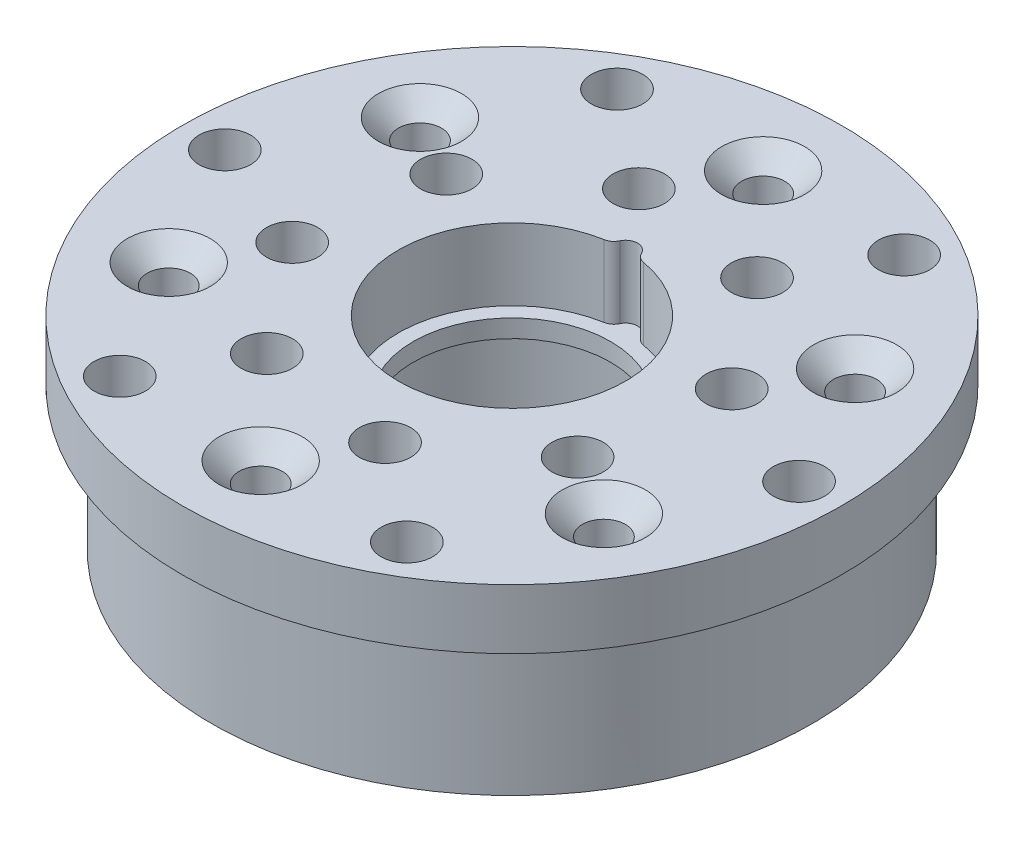
from build123d import *

# Parameters (mm, degrees)
SKETCH1_R                                            = 25.1
SKETCH1_R_2                                          = 2.5
SKETCH1_R_3                                          = 8.25
BOSS_EXTRUDE1_DEPTH                                  = 10
SKETCH2_R                                            = 15.5
SKETCH2_R_2                                          = 9.5
BOSS_EXTRUDE2_DEPTH                                  = 8.5
SKETCH4_R                                            = 9.5
SKETCH4_R_2                                          = 8.25
BOSS_EXTRUDE3_DEPTH                                  = 2.5
SKETCH3_R                                            = 12.5
CUT_EXTRUDE1_DEPTH                                   = 11
CHAMFER1_SIZE                                        = 3
SKETCH5_R                                            = 25.1
SKETCH5_R_2                                          = 2.5
SKETCH5_R_3                                          = 15.5
BOSS_EXTRUDE4_DEPTH                                  = 8.5
BOSS_EXTRUDE5_START                                  = -5
SKETCH6_R                                            = 27.55
SKETCH6_R_2                                          = 25.1
BOSS_EXTRUDE5_DEPTH                                  = 5
SKETCH8_R                                            = 1
CUT_EXTRUDE2_DEPTH                                   = 6
FILLET1_R                                            = 1
SKETCH11_R                                           = 2.15
CUT_EXTRUDE3_DEPTH                                   = 4.8
SKETCH12_R                                           = 25.1
SKETCH12_R_2                                         = 2.5
SKETCH12_R_3                                         = 12.5
CUT_EXTRUDE4_DEPTH                                   = 1.5
BOSS_EXTRUDE8_START                                  = -4.5
SKETCH14_R                                           = 2.5
SKETCH14_R_2                                         = 1.5
BOSS_EXTRUDE8_DEPTH                                  = 4.5
CSK_FOR_M3_SOCKET_COUNTERSUNK_HEAD_SCREW_D           = 3.6
CSK_FOR_M3_SOCKET_COUNTERSUNK_HEAD_SCREW_CSINK_D     = 6.94
CSK_FOR_M3_SOCKET_COUNTERSUNK_HEAD_SCREW_CSINK_ANGLE = 90


with BuildPart() as part:
    # Sketch1 → Boss-Extrude1 (new body)
    with BuildSketch(Plane(origin=(0, 0, 0), x_dir=(1, 0, 0), z_dir=(0, 1, 0))):
        with Locations(Location((0, 0, 0), (0, 0, 270))):
            Circle(SKETCH1_R)
        with Locations(Location((0, 21, 0), (0, 0, 270))):
            Circle(SKETCH1_R_2, mode=Mode.SUBTRACT)
        with Locations(Location((18.186533479, 10.5, 0), (0, 0, 270))):
            Circle(SKETCH1_R_2, mode=Mode.SUBTRACT)
        with Locations(Location((18.186533479, -10.5, 0), (0, 0, 270))):
            Circle(SKETCH1_R_2, mode=Mode.SUBTRACT)
        with Locations(Location((0, -21, 0), (0, 0, 270))):
            Circle(SKETCH1_R_2, mode=Mode.SUBTRACT)
        with Locations(Location((-18.186533479, -10.5, 0), (0, 0, 270))):
            Circle(SKETCH1_R_2, mode=Mode.SUBTRACT)
        with Locations(Location((-18.186533479, 10.5, 0), (0, 0, 270))):
            Circle(SKETCH1_R_2, mode=Mode.SUBTRACT)
        with Locations(Location((0, 0, 0), (0, 0, 270))):
            Circle(SKETCH1_R_3, mode=Mode.SUBTRACT)
    extrude(amount=BOSS_EXTRUDE1_DEPTH)

    # Sketch2 → Boss-Extrude2 (add)
    with BuildSketch(Plane(origin=(0, 10, 0), x_dir=(1, 0, 0), z_dir=(0, 1, 0))):
        with Locations(Location((0, 0, 0), (0, 0, 270))):
            Circle(SKETCH2_R)
        with Locations(Location((0, 0, 0), (0, 0, 270))):
            Circle(SKETCH2_R_2, mode=Mode.SUBTRACT)
    extrude(amount=BOSS_EXTRUDE2_DEPTH)

    # Sketch4 → Boss-Extrude3 (add)
    with BuildSketch(Plane(origin=(0, 10, 0), x_dir=(1, 0, 0), z_dir=(0, 1, 0))):
        with Locations(Location((0, 0, 0), (0, 0, 270))):
            Circle(SKETCH4_R)
        with Locations(Location((0, 0, 0), (0, 0, 270))):
            Circle(SKETCH4_R_2, mode=Mode.SUBTRACT)
    extrude(amount=BOSS_EXTRUDE3_DEPTH)

    # Sketch3 → Cut-Extrude1 (cut)
    with BuildSketch(Plane.XZ):
        with Locations(Location((0, 0, 0), (0, 0, 270))):
            Circle(SKETCH3_R)
    extrude(amount=-CUT_EXTRUDE1_DEPTH, mode=Mode.SUBTRACT)

    # Chamfer1
    chamfer1_edges = [part.edges().sort_by_distance(p)[0] for p in [
        (0, 11, 12.5),
    ]]
    chamfer(chamfer1_edges, length=CHAMFER1_SIZE)

    # Sketch5 → Boss-Extrude4 (add)
    with BuildSketch(Plane(origin=(0, 10, 0), x_dir=(1, 0, 0), z_dir=(0, 1, 0))):
        with Locations(Location((0, 0, 0), (0, 0, 270))):
            Circle(SKETCH5_R)
        with Locations(Location((0, 21, 0), (0, 0, 270))):
            Circle(SKETCH5_R_2, mode=Mode.SUBTRACT)
        with Locations(Location((18.187152059, 10.499642863, 0), (0, 0, 60.008184899))):
            Circle(SKETCH5_R_2, mode=Mode.SUBTRACT)
        with Locations(Location((18.187152059, -10.50107141, 0), (0, 0, 30.014176717))):
            Circle(SKETCH5_R_2, mode=Mode.SUBTRACT)
        with Locations(Location((0, -21.001428547, 0), (0, 0, 179.983629985))):
            Circle(SKETCH5_R_2, mode=Mode.SUBTRACT)
        with Locations(Location((-18.187152059, -10.50107141, 0), (0, 0, 149.985823141))):
            Circle(SKETCH5_R_2, mode=Mode.SUBTRACT)
        with Locations(Location((-18.187152059, 10.499642863, 0), (0, 0, 119.991814957))):
            Circle(SKETCH5_R_2, mode=Mode.SUBTRACT)
        Circle(SKETCH5_R_3, mode=Mode.SUBTRACT)
    extrude(amount=BOSS_EXTRUDE4_DEPTH)

    # Sketch6 → Boss-Extrude5 (add)
    with BuildSketch(Plane(origin=(0, 18.5, 0), x_dir=(1, 0, 0), z_dir=(0, 1, 0)).offset(BOSS_EXTRUDE5_START)):
        with Locations(Location((0, 0, 0), (0, 0, 270))):
            Circle(SKETCH6_R)
        with Locations(Location((0, 0, 0), (0, 0, 270))):
            Circle(SKETCH6_R_2, mode=Mode.SUBTRACT)
    extrude(amount=BOSS_EXTRUDE5_DEPTH)

    # Sketch8 → Cut-Extrude2 (cut)
    with BuildSketch(Plane(origin=(0, 18.5, 0), x_dir=(1, 0, 0), z_dir=(0, 1, 0))):
        with Locations((0, 9.5)):
            Circle(SKETCH8_R)
    extrude(amount=-CUT_EXTRUDE2_DEPTH, mode=Mode.SUBTRACT)

    # Fillet1
    fillet1_edges = [part.edges().sort_by_distance(p)[0] for p in [
        (0.998613998, 15.5, -9.447368421),
        (-0.998613998, 15.5, -9.447368421),
    ]]
    fillet(fillet1_edges, radius=FILLET1_R)

    # Sketch11 → Cut-Extrude3 (cut)
    with BuildSketch(Plane(origin=(0, 18.5, 0), x_dir=(1, 0, 0), z_dir=(0, 1, 0))):
        with Locations(Location((7.5, 12.990381057, 0), (0, 0, 270))):
            Circle(SKETCH11_R)
        with Locations(Location((14.488887394, 3.882285677, 0), (0, 0, 270))):
            Circle(SKETCH11_R)
        with Locations(Location((12.990381057, -7.5, 0), (0, 0, 270))):
            Circle(SKETCH11_R)
        with Locations(Location((3.882285677, -14.488887394, 0), (0, 0, 270))):
            Circle(SKETCH11_R)
        with Locations(Location((-7.5, -12.990381057, 0), (0, 0, 270))):
            Circle(SKETCH11_R)
        with Locations(Location((-14.488887394, -3.882285677, 0), (0, 0, 270))):
            Circle(SKETCH11_R)
        with Locations(Location((-24, 0, 0), (0, 0, 270))):
            Circle(SKETCH11_R)
        with Locations(Location((-12, 20.784609691, 0), (0, 0, 270))):
            Circle(SKETCH11_R)
        with Locations(Location((12, 20.784609691, 0), (0, 0, 270))):
            Circle(SKETCH11_R)
        with Locations(Location((24, 0, 0), (0, 0, 270))):
            Circle(SKETCH11_R)
        with Locations(Location((12, -20.784609691, 0), (0, 0, 270))):
            Circle(SKETCH11_R)
        with Locations(Location((-12, -20.784609691, 0), (0, 0, 270))):
            Circle(SKETCH11_R)
        with Locations(Location((-12.990381057, 7.5, 0), (0, 0, 270))):
            Circle(SKETCH11_R)
        with Locations(Location((-3.882285677, 14.488887394, 0), (0, 0, 270))):
            Circle(SKETCH11_R)
    extrude(amount=-CUT_EXTRUDE3_DEPTH, mode=Mode.SUBTRACT)

    # Sketch12 → Cut-Extrude4 (cut)
    with BuildSketch(Plane.XZ):
        with Locations(Location((0, 0, 0), (0, 0, 270))):
            Circle(SKETCH12_R)
        with Locations(Location((18.186533479, 10.5, 0), (0, 0, 270))):
            Circle(SKETCH12_R_2, mode=Mode.SUBTRACT)
        with Locations(Location((18.186533479, -10.5, 0), (0, 0, 270))):
            Circle(SKETCH12_R_2, mode=Mode.SUBTRACT)
        with Locations(Location((0, -21, 0), (0, 0, 270))):
            Circle(SKETCH12_R_2, mode=Mode.SUBTRACT)
        with Locations(Location((-18.186533479, -10.5, 0), (0, 0, 270))):
            Circle(SKETCH12_R_2, mode=Mode.SUBTRACT)
        with Locations(Location((-18.186533479, 10.5, 0), (0, 0, 270))):
            Circle(SKETCH12_R_2, mode=Mode.SUBTRACT)
        with Locations(Location((0, 21, 0), (0, 0, 270))):
            Circle(SKETCH12_R_2, mode=Mode.SUBTRACT)
        with Locations(Location((0, 0, 0), (0, 0, 270))):
            Circle(SKETCH12_R_3, mode=Mode.SUBTRACT)
    extrude(amount=-CUT_EXTRUDE4_DEPTH, mode=Mode.SUBTRACT)

    # Sketch14 → Boss-Extrude8 (add)
    # profile 1 of 6: a face of its own
    with BuildSketch(Plane(origin=(0, 18.5, 0), x_dir=(1, 0, 0), z_dir=(0, 1, 0)).offset(BOSS_EXTRUDE8_START)):
        with Locations(Location((0, 21, 0), (0, 0, 90))):
            Circle(SKETCH14_R)
        with Locations(Location((0, 21, 0), (0, 0, 270))):
            Circle(SKETCH14_R_2, mode=Mode.SUBTRACT)
    # profile 2 of 6: a face of its own
    with BuildSketch(Plane(origin=(0, 18.5, 0), x_dir=(1, 0, 0), z_dir=(0, 1, 0)).offset(BOSS_EXTRUDE8_START)):
        with Locations(Location((18.187152059, 10.499642863, 0), (0, 0, 60.008184899))):
            Circle(SKETCH14_R)
        with Locations(Location((18.187152059, 10.499642863, 0), (0, 0, 270))):
            Circle(SKETCH14_R_2, mode=Mode.SUBTRACT)
    # profile 3 of 6: a face of its own
    with BuildSketch(Plane(origin=(0, 18.5, 0), x_dir=(1, 0, 0), z_dir=(0, 1, 0)).offset(BOSS_EXTRUDE8_START)):
        with Locations(Location((18.187152059, -10.50107141, 0), (0, 0, 30.014176717))):
            Circle(SKETCH14_R)
        with Locations(Location((18.187152059, -10.50107141, 0), (0, 0, 270))):
            Circle(SKETCH14_R_2, mode=Mode.SUBTRACT)
    # profile 4 of 6: a face of its own
    with BuildSketch(Plane(origin=(0, 18.5, 0), x_dir=(1, 0, 0), z_dir=(0, 1, 0)).offset(BOSS_EXTRUDE8_START)):
        with Locations(Location((0, -21.001428547, 0), (0, 0, 179.983629985))):
            Circle(SKETCH14_R)
        with Locations(Location((0, -21.001428547, 0), (0, 0, 270))):
            Circle(SKETCH14_R_2, mode=Mode.SUBTRACT)
    # profile 5 of 6: a face of its own
    with BuildSketch(Plane(origin=(0, 18.5, 0), x_dir=(1, 0, 0), z_dir=(0, 1, 0)).offset(BOSS_EXTRUDE8_START)):
        with Locations(Location((-18.187152059, -10.50107141, 0), (0, 0, 149.985823141))):
            Circle(SKETCH14_R)
        with Locations(Location((-18.187152059, -10.50107141, 0), (0, 0, 270))):
            Circle(SKETCH14_R_2, mode=Mode.SUBTRACT)
    # profile 6 of 6: a face of its own
    with BuildSketch(Plane(origin=(0, 18.5, 0), x_dir=(1, 0, 0), z_dir=(0, 1, 0)).offset(BOSS_EXTRUDE8_START)):
        with Locations(Location((-18.187152059, 10.499642863, 0), (0, 0, 119.991814957))):
            Circle(SKETCH14_R)
        with Locations(Location((-18.187152059, 10.499642863, 0), (0, 0, 270))):
            Circle(SKETCH14_R_2, mode=Mode.SUBTRACT)
    extrude(amount=BOSS_EXTRUDE8_DEPTH)

    # CSK for M3 socket countersunk head screw1 (through all)
    with Locations(Plane(origin=(0, 18.5, 0), x_dir=(1, 0, 0), z_dir=(0, 1, 0))):
        with Locations((0, 21), (18.187152059, 10.499642863), (18.187152059, -10.50107141), (0, -21.001428547), (-18.187152059, -10.50107141), (-18.187152059, 10.499642863)):
            CounterSinkHole(CSK_FOR_M3_SOCKET_COUNTERSUNK_HEAD_SCREW_D / 2, CSK_FOR_M3_SOCKET_COUNTERSUNK_HEAD_SCREW_CSINK_D / 2, counter_sink_angle=CSK_FOR_M3_SOCKET_COUNTERSUNK_HEAD_SCREW_CSINK_ANGLE)


solid = part.part
